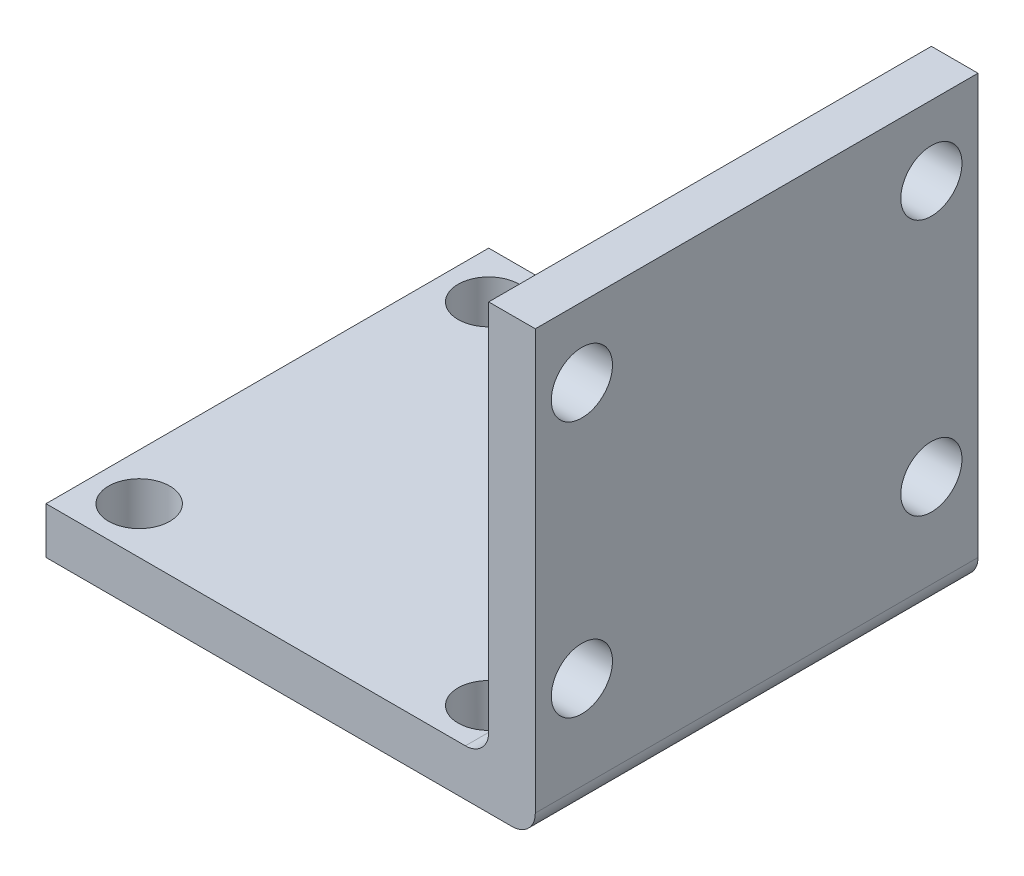
from build123d import *

# Parameters (mm, degrees)
SKETCH1_W               = 266.7
SKETCH1_H               = 241.3
BOSS_EXTRUDE1_DEPTH     = 25.4
SKETCH2_W               = 25.4
SKETCH2_H               = 241.3
BOSS_EXTRUDE2_DEPTH     = 215.9
FILLET1_R               = 12.7
CUT_EXTRUDE1_DEPTH      = 420.484671949
CUT_EXTRUDE1_DEPTH_BACK = 420.484671949
SKETCH4_R               = 16.6751
CUT_EXTRUDE2_DEPTH      = 418.943859924
CUT_EXTRUDE2_DEPTH_BACK = 418.943859924
SKETCH5_R               = 16.6751


with BuildPart() as part:
    # Sketch1 → Boss-Extrude1 (new body)
    with BuildSketch(Plane(origin=(0, 0, 0), x_dir=(1, 0, 0), z_dir=(0, 1, 0))):
        with Locations((133.35, -120.65)):
            Rectangle(SKETCH1_W, SKETCH1_H)
    extrude(amount=BOSS_EXTRUDE1_DEPTH)

    # Sketch2 → Boss-Extrude2 (add)
    with BuildSketch(Plane(origin=(0, 25.4, 0), x_dir=(1, 0, 0), z_dir=(0, 1, 0))):
        with Locations((254, -120.65)):
            Rectangle(SKETCH2_W, SKETCH2_H)
    extrude(amount=BOSS_EXTRUDE2_DEPTH)

    # Fillet1
    fillet1_edges = [part.edges().sort_by_distance(p)[0] for p in [
        (241.3, 25.4, 120.65),
        (266.7, 0, 120.65),
    ]]
    fillet(fillet1_edges, radius=FILLET1_R)

    # Sketch4 → Cut-Extrude1 (cut, two sides: drawn at the far end of the back side and taken through both)
    with BuildSketch(Plane(origin=(0, 25.4, 0), x_dir=(1, 0, 0), z_dir=(0, 1, 0)).offset(-CUT_EXTRUDE1_DEPTH_BACK)):
        with Locations(Location((25.4, -215.9, 0), (0, 0, 270))):
            Circle(SKETCH4_R)
        with Locations(Location((215.9, -215.9, 0), (0, 0, 270))):
            Circle(SKETCH4_R)
        with Locations(Location((25.4, -25.4, 0), (0, 0, 270))):
            Circle(SKETCH4_R)
        with Locations(Location((215.9, -25.4, 0), (0, 0, 270))):
            Circle(SKETCH4_R)
    extrude(amount=CUT_EXTRUDE1_DEPTH + CUT_EXTRUDE1_DEPTH_BACK, mode=Mode.SUBTRACT)

    # Sketch5 → Cut-Extrude2 (cut, two sides: drawn at the far end of the back side and taken through both)
    with BuildSketch(Plane.ZY.offset(-241.3).offset(-CUT_EXTRUDE2_DEPTH_BACK)):
        with Locations((25.4, 63.5)):
            Circle(SKETCH5_R)
        with Locations((25.4, 203.2)):
            Circle(SKETCH5_R)
        with Locations((215.9, 63.5)):
            Circle(SKETCH5_R)
        with Locations((215.9, 203.2)):
            Circle(SKETCH5_R)
    extrude(amount=CUT_EXTRUDE2_DEPTH + CUT_EXTRUDE2_DEPTH_BACK, mode=Mode.SUBTRACT)


solid = part.part
